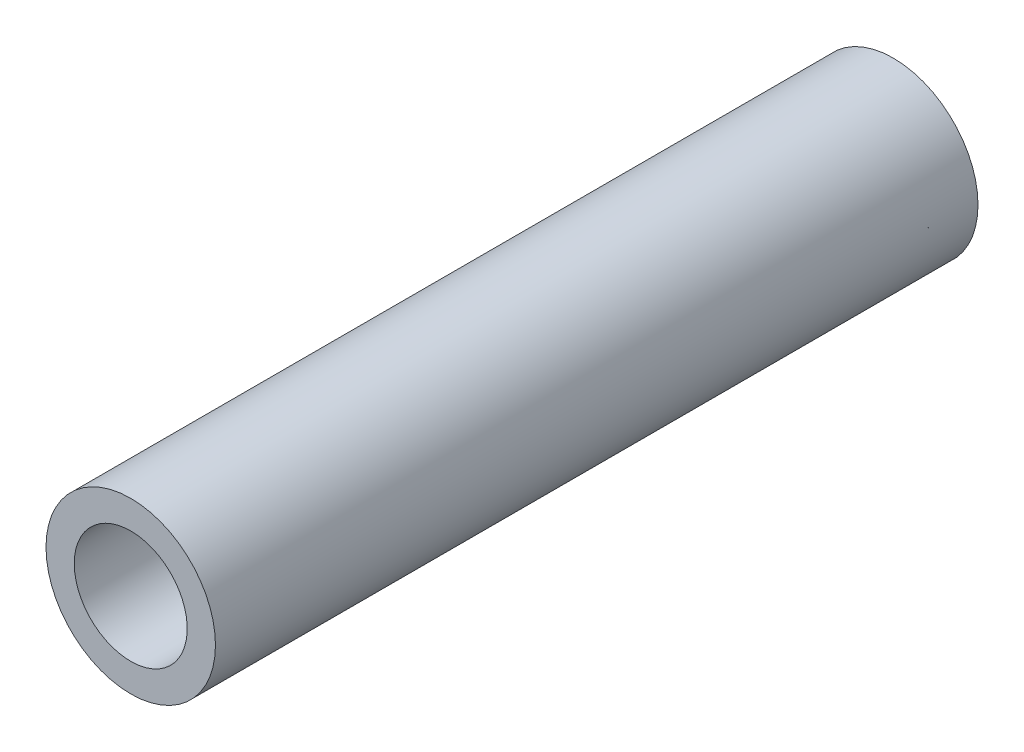
from build123d import *

# Parameters (mm, degrees)
SCHIZZO2_R                   = 3
SCHIZZO2_R_2                 = 2
ESTRUSIONE_ESTRUSIONE1_DEPTH = 27


with BuildPart() as part:
    # Schizzo2 → Estrusione-Estrusione1 (new body)
    with BuildSketch(Plane.XY):
        with Locations(Location((13, -54.5, 0), (0, 0, 180))):
            Circle(SCHIZZO2_R)
        with Locations(Location((13, -54.5, 0), (0, 0, 180))):
            Circle(SCHIZZO2_R_2, mode=Mode.SUBTRACT)
    extrude(amount=ESTRUSIONE_ESTRUSIONE1_DEPTH)


solid = part.part
